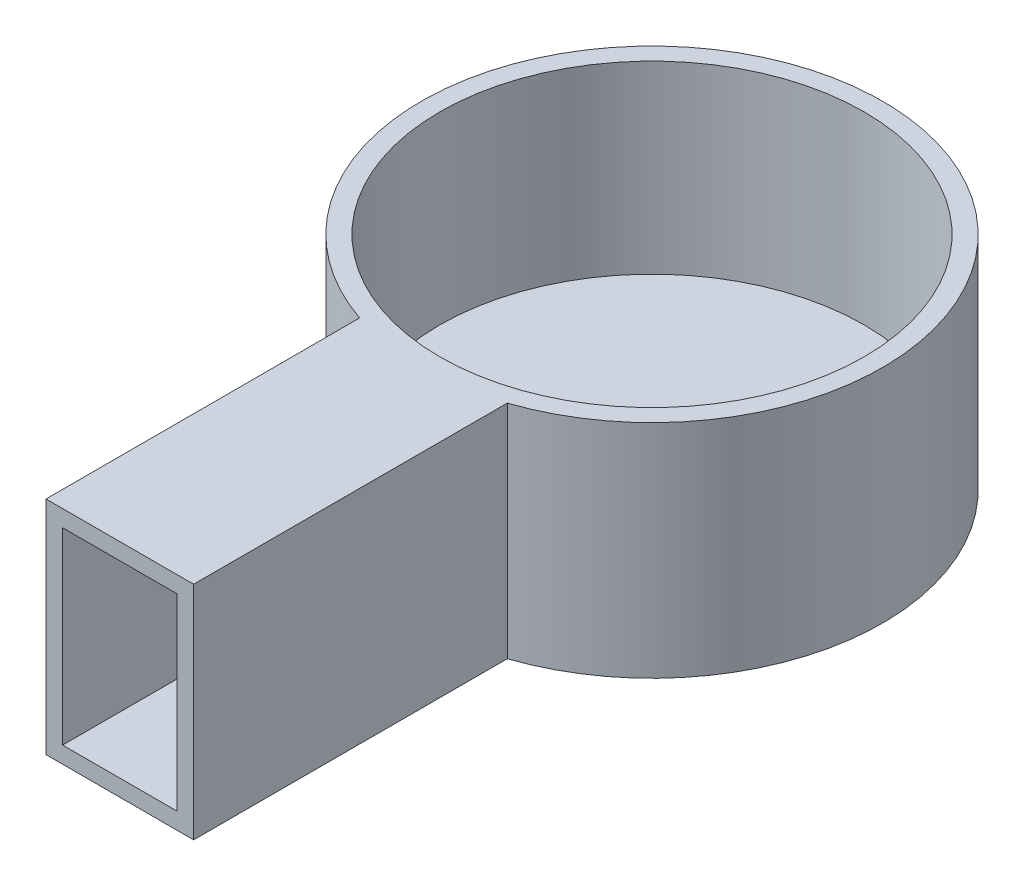
from build123d import *

# Parameters (mm, degrees)
ESBO_O2_W                = 8
ESBO_O2_H                = 12
RESSALTO_EXTRUS_O1_DEPTH = 17
ESBO_O3_W                = 6.2
ESBO_O3_H                = 10.2
CORTE_EXTRUS_O1_DEPTH    = 15
ESBO_O4_R                = 12.5
RESSALTO_EXTRUS_O2_DEPTH = 12
ESBO_O5_R                = 11.5
CORTE_EXTRUS_O2_DEPTH    = 10


with BuildPart() as part:
    # Esboço2 → Ressalto-extrusão1 (new body)
    with BuildSketch(Plane.XY):
        Rectangle(ESBO_O2_W, ESBO_O2_H)
    extrude(amount=RESSALTO_EXTRUS_O1_DEPTH)

    # Esboço3 → Corte-extrusão1 (cut)
    with BuildSketch(Plane.XY.offset(17)):
        Rectangle(ESBO_O3_W, ESBO_O3_H)
    extrude(amount=-CORTE_EXTRUS_O1_DEPTH, mode=Mode.SUBTRACT)

    # Esboço4 → Ressalto-extrusão2 (add)
    with BuildSketch(Plane(origin=(0, 6, 0), x_dir=(1, 0, 0), z_dir=(0, 1, 0))):
        with Locations((0, 11.842719282)):
            Circle(ESBO_O4_R)
    extrude(amount=-RESSALTO_EXTRUS_O2_DEPTH)

    # Esboço5 → Corte-extrusão2 (cut)
    with BuildSketch(Plane(origin=(0, 6, 0), x_dir=(1, 0, 0), z_dir=(0, 1, 0))):
        with Locations(Location((0, 11.842719282, 0), (0, 0, 180))):
            Circle(ESBO_O5_R)
    extrude(amount=-CORTE_EXTRUS_O2_DEPTH, mode=Mode.SUBTRACT)


solid = part.part
